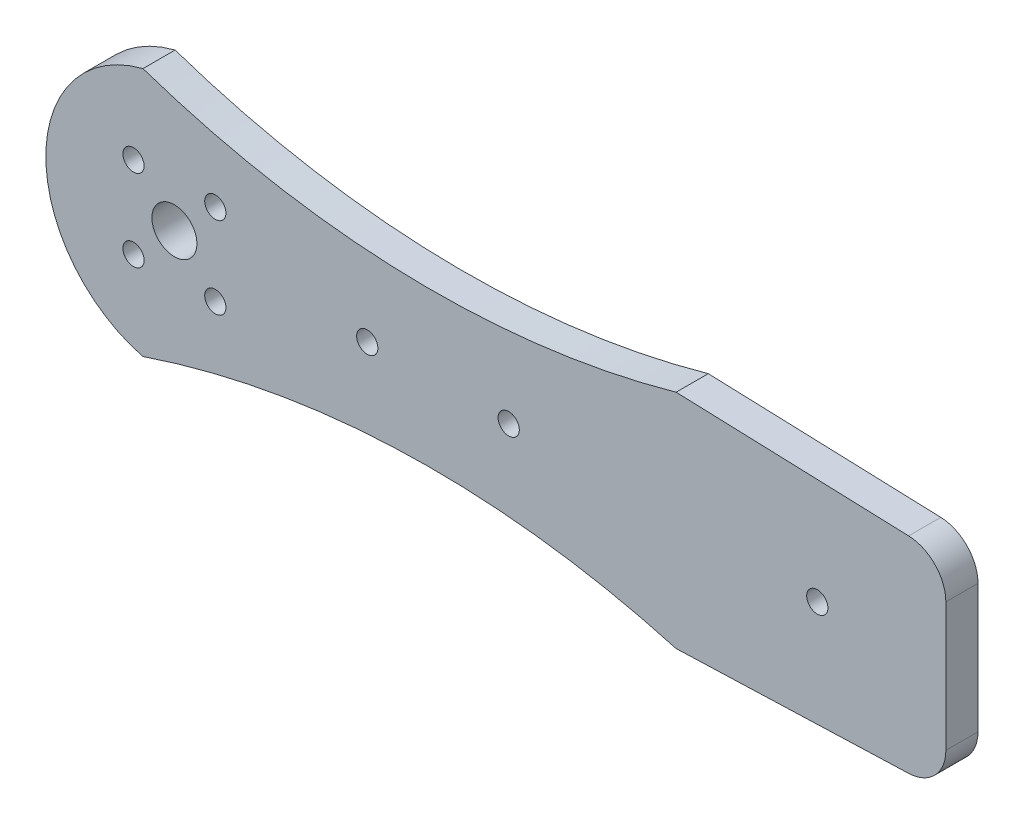
from build123d import *

# Parameters (mm, degrees)
PLASTINA_DEPTH        = 5
OTVERSTIYA_DEPTH      = 122.659652126
OTVERSTIYA_DEPTH_BACK = 122.659652126
ESKIZ_OTVERSTIYA_R    = 1.65
ESKIZ_OTVERSTIYA_R_2  = 3.5


with BuildPart() as part:
    # Eskiz_kontur → Plastina (new body)
    with BuildSketch(Plane.XY):
        with BuildLine():
            Line((78.04349, 17.26807), (114.2094, 15.99634))
            ThreePointArc((114.2094, 15.99634), (118.316039529, 14.167943464), (119.999997488, 9.999993404))
            Line((119.999997488, 9.999993404), (119.999997488, -10.000006596))
            ThreePointArc((119.999997488, -10.000006596), (118.31603808, -14.167953985), (114.2094, -15.996349022))
            Line((114.2094, -15.996349022), (78.04349, -17.268079022))
            ThreePointArc((78.04349, -17.268079022), (36.414907375, -12.045919499), (-4.891710116, -19.392564511))
            ThreePointArc((-4.891710116, -19.392564511), (-20.000005367, -4.511e-06), (-4.891710116, 19.392555489))
            ThreePointArc((-4.891710116, 19.392555489), (36.414907375, 12.045910477), (78.04349, 17.26807))
        make_face()
    extrude(amount=PLASTINA_DEPTH)

    # Eskiz_otverstiya → Otverstiya (cut, two sides: drawn at the far end of the back side and taken through both)
    with BuildSketch(Plane.XY.offset(-OTVERSTIYA_DEPTH_BACK)):
        with Locations((-6.36396, -6.36396)):
            Circle(ESKIZ_OTVERSTIYA_R)
        with Locations((6.36396, -6.36396)):
            Circle(ESKIZ_OTVERSTIYA_R)
        Circle(ESKIZ_OTVERSTIYA_R_2)
        with Locations((30, 0)):
            Circle(ESKIZ_OTVERSTIYA_R)
        with Locations((-6.36396, 6.36396)):
            Circle(ESKIZ_OTVERSTIYA_R)
        with Locations((6.36396, 6.36396)):
            Circle(ESKIZ_OTVERSTIYA_R)
        with Locations((52, 0)):
            Circle(ESKIZ_OTVERSTIYA_R)
        with Locations((100, 0)):
            Circle(ESKIZ_OTVERSTIYA_R)
    extrude(amount=OTVERSTIYA_DEPTH + OTVERSTIYA_DEPTH_BACK, mode=Mode.SUBTRACT)


solid = part.part
